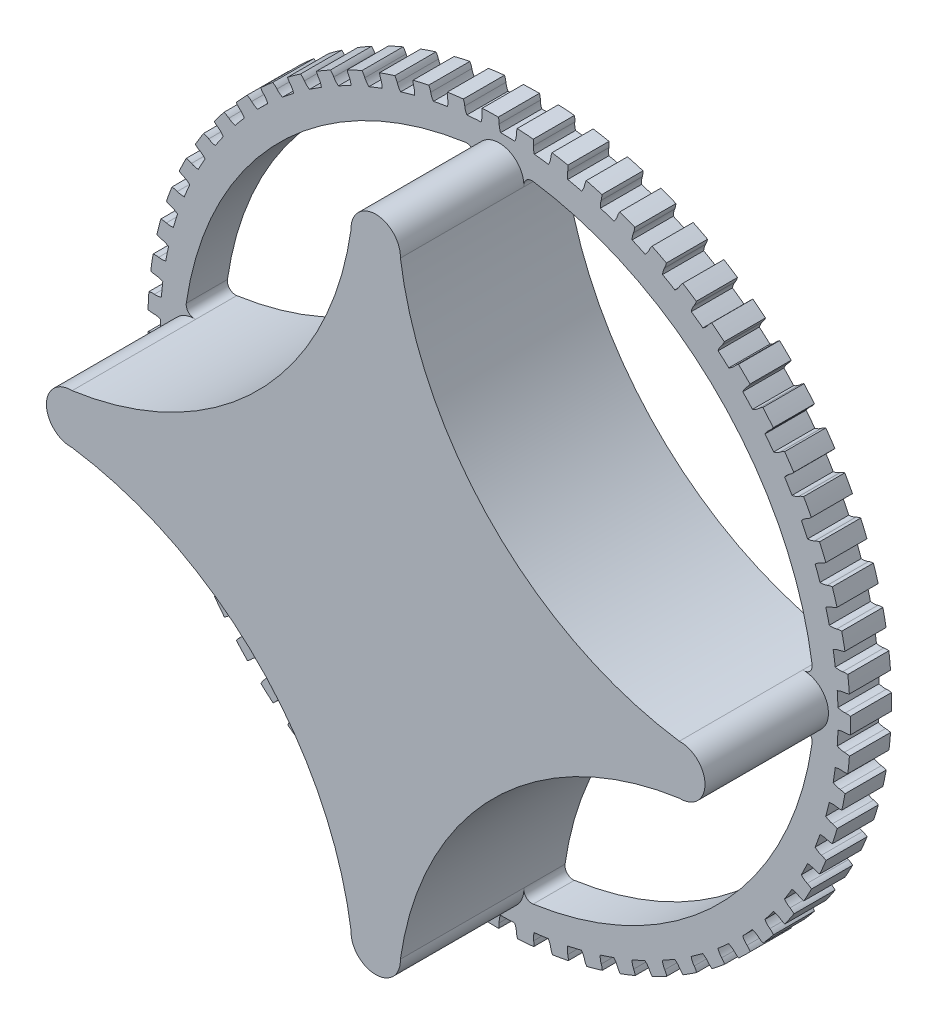
from build123d import *

# Parameters (mm, degrees)
CROQUIS1_R              = 40
SALIENTE_EXTRUIR1_DEPTH = 5
SALIENTE_EXTRUIR2_DEPTH = 15
CORTAR_EXTRUIR1_START   = -15
CORTAR_EXTRUIR1_DEPTH   = 15
CROQUIS4_R              = 42.6665
CROQUIS4_R_2            = 40
SALIENTE_EXTRUIR3_DEPTH = 5
CORTAR_EXTRUIR3_DEPTH   = 15


with BuildPart() as part:
    # Croquis1 → Saliente-Extruir1 (new body)
    with BuildSketch(Plane.XY):
        Circle(CROQUIS1_R)
    extrude(amount=SALIENTE_EXTRUIR1_DEPTH)

    # Croquis2 → Saliente-Extruir2 (add)
    with BuildSketch(Plane.XY.offset(5)):
        with BuildLine():
            ThreePointArc((36.878378378, -2.997533683), (40, 0), (36.878378378, 2.997533683))
            ThreePointArc((36.878378378, 2.997533683), (14.303675748, 14.303675748), (2.997533683, 36.878378378))
            ThreePointArc((2.997533683, 36.878378378), (0, 40), (-2.997533683, 36.878378378))
            ThreePointArc((-2.997533683, 36.878378378), (-14.303675748, 14.303675748), (-36.878378378, 2.997533683))
            ThreePointArc((-36.878378378, 2.997533683), (-40, 0), (-36.878378378, -2.997533683))
            ThreePointArc((-36.878378378, -2.997533683), (-14.303675748, -14.303675748), (-2.997533683, -36.878378378))
            ThreePointArc((-2.997533683, -36.878378378), (0, -40), (2.997533683, -36.878378378))
            ThreePointArc((2.997533683, -36.878378378), (14.303675748, -14.303675748), (36.878378378, -2.997533683))
        make_face()
    extrude(amount=SALIENTE_EXTRUIR2_DEPTH)

    # Croquis3 → Cortar-Extruir1 (cut)
    with BuildSketch(Plane.XY.offset(5).offset(CORTAR_EXTRUIR1_START)):
        with BuildLine():
            ThreePointArc((2.997533683, -36.878378378), (14.303675748, -14.303675748), (36.878378378, -2.997533683))
            ThreePointArc((36.878378378, -2.997533683), (37.728224375, -3.280187235), (38.010877927, -4.130033231))
            ThreePointArc((38.010877927, -4.130033231), (26.704735862, -26.704735862), (4.130033231, -38.010877927))
            ThreePointArc((4.130033231, -38.010877927), (3.280187235, -37.728224375), (2.997533683, -36.878378378))
        make_face()
        with BuildLine():
            ThreePointArc((-36.878378378, -2.997533683), (-14.303675748, -14.303675748), (-2.997533683, -36.878378378))
            ThreePointArc((-2.997533683, -36.878378378), (-3.280187235, -37.728224375), (-4.130033231, -38.010877927))
            ThreePointArc((-4.130033231, -38.010877927), (-26.704735862, -26.704735862), (-38.010877927, -4.130033231))
            ThreePointArc((-38.010877927, -4.130033231), (-37.728224375, -3.280187235), (-36.878378378, -2.997533683))
        make_face()
        with BuildLine():
            ThreePointArc((-2.997533683, 36.878378378), (-14.303675748, 14.303675748), (-36.878378378, 2.997533683))
            ThreePointArc((-36.878378378, 2.997533683), (-37.728224375, 3.280187235), (-38.010877927, 4.130033231))
            ThreePointArc((-38.010877927, 4.130033231), (-26.704735862, 26.704735862), (-4.130033231, 38.010877927))
            ThreePointArc((-4.130033231, 38.010877927), (-3.280187235, 37.728224375), (-2.997533683, 36.878378378))
        make_face()
        with BuildLine():
            ThreePointArc((36.878378378, 2.997533683), (14.303675748, 14.303675748), (2.997533683, 36.878378378))
            ThreePointArc((2.997533683, 36.878378378), (3.280187235, 37.728224375), (4.130033231, 38.010877927))
            ThreePointArc((4.130033231, 38.010877927), (26.704735862, 26.704735862), (38.010877927, 4.130033231))
            ThreePointArc((38.010877927, 4.130033231), (37.728224375, 3.280187235), (36.878378378, 2.997533683))
        make_face()
    extrude(amount=CORTAR_EXTRUIR1_DEPTH, mode=Mode.SUBTRACT)

    # Croquis4 → Saliente-Extruir3 (add)
    with BuildSketch(Plane.XY):
        Circle(CROQUIS4_R)
        Circle(CROQUIS4_R_2, mode=Mode.SUBTRACT)
    extrude(amount=SALIENTE_EXTRUIR3_DEPTH)

    # Croquis8 → Cortar-Extruir3 (cut)
    with BuildSketch(Plane.XY.offset(5)):
        with BuildLine():
            ThreePointArc((2.185445789, 42.61049224), (1.038684561, 42.65385512), (-0.108828076, 42.666361208))
            ThreePointArc((-0.108828076, 42.666361208), (-0.027386058, 42.337594731), (0, 42))
            ThreePointArc((0, 42), (0.043743307, 41.57417464), (0.173146085, 41.166135873))
            ThreePointArc((0.173146085, 41.166135873), (1.037722983, 41.153418488), (1.901842061, 41.122545143))
            ThreePointArc((1.901842061, 41.122545143), (2.045768614, 41.550821832), (2.0945, 42))
            ThreePointArc((2.0945, 42), (2.117361211, 42.308614611), (2.185445789, 42.61049224))
        make_face()
        with BuildLine():
            ThreePointArc((6.417220773, 42.181151001), (5.280475608, 42.338478948), (4.139910423, 42.465178252))
            ThreePointArc((4.139910423, 42.465178252), (4.188213167, 42.129936483), (4.181849557, 41.791292565))
            ThreePointArc((4.181849557, 41.791292565), (4.18297698, 41.3632278), (4.271109185, 40.944332313))
            ThreePointArc((4.271109185, 40.944332313), (5.130123563, 40.845594064), (5.986874647, 40.72883566))
            ThreePointArc((5.986874647, 40.72883566), (6.172728585, 41.140653689), (6.265941516, 41.582747711))
            ThreePointArc((6.265941516, 41.582747711), (6.319417217, 41.887552505), (6.417220773, 42.181151001))
        make_face()
        with BuildLine():
            ThreePointArc((10.585218534, 41.332594533), (9.469786915, 41.60232395), (8.347504632, 41.841957276))
            ThreePointArc((8.347504632, 41.841957276), (8.362188047, 41.503571999), (8.322138014, 41.16724449))
            ThreePointArc((8.322138014, 41.16724449), (8.280638348, 40.741194619), (8.326624082, 40.315605584))
            ThreePointArc((8.326624082, 40.315605584), (9.171538671, 40.131827776), (10.012406983, 39.93034471))
            ThreePointArc((10.012406983, 39.93034471), (10.238341205, 40.321611246), (10.37510929, 40.752227393))
            ThreePointArc((10.37510929, 40.752227393), (10.458668015, 41.050193083), (10.585218534, 41.332594533))
        make_face()
        with BuildLine():
            ThreePointArc((14.648015637, 40.073256171), (13.564983226, 40.452706366), (12.47213759, 40.80289213))
            ThreePointArc((12.47213759, 40.80289213), (12.453055746, 40.46472637), (12.379717325, 40.134057843))
            ThreePointArc((12.379717325, 40.134057843), (12.296003012, 39.714257143), (12.299385249, 39.286204255))
            ThreePointArc((12.299385249, 39.286204255), (13.121802906, 39.019213354), (13.93843152, 38.735008055))
            ThreePointArc((13.93843152, 38.735008055), (14.202200591, 39.101834516), (14.381164567, 39.51669313))
            ThreePointArc((14.381164567, 39.51669313), (14.493975872, 39.8048584), (14.648015637, 40.073256171))
        make_face()
        with BuildLine():
            ThreePointArc((18.56523418, 38.415651785), (17.525364639, 38.901051612), (16.472816841, 39.358309511))
            ThreePointArc((16.472816841, 39.358309511), (16.420159383, 39.02372411), (16.314261444, 38.702000899))
            ThreePointArc((16.314261444, 38.702000899), (16.189164474, 38.292621536), (16.1499096, 37.866358977))
            ThreePointArc((16.1499096, 37.866358977), (16.94165677, 37.518808459), (17.725929662, 37.154705487))
            ThreePointArc((17.725929662, 37.154705487), (18.024912126, 37.493446187), (18.244293369, 37.888424218))
            ThreePointArc((18.244293369, 37.888424218), (18.385236085, 38.16392515), (18.56523418, 38.415651785))
        make_face()
        with BuildLine():
            ThreePointArc((22.297943085, 36.376255393), (21.311571104, 36.96278073), (20.309781837, 37.52256633))
            ThreePointArc((20.309781837, 37.52256633), (20.224072098, 37.194886549), (20.086667102, 36.885306082))
            ThreePointArc((20.086667102, 36.885306082), (19.921430746, 36.490416653), (19.839928893, 36.070180812))
            ThreePointArc((19.839928893, 36.070180812), (20.593136836, 35.645524789), (21.337259552, 35.205142764))
            ThreePointArc((21.337259552, 35.205142764), (21.668483987, 35.512431145), (21.926102188, 35.883603123))
            ThreePointArc((21.926102188, 35.883603123), (22.093775562, 36.143701667), (22.297943085, 36.376255393))
        make_face()
        with BuildLine():
            ThreePointArc((25.809045013, 33.975335433), (24.885973602, 34.657157127), (23.944899097, 35.313907027))
            ThreePointArc((23.944899097, 35.313907027), (23.826988899, 34.996389494), (23.659442439, 34.702028521))
            ThreePointArc((23.659442439, 34.702028521), (23.455708889, 34.325553615), (23.332770059, 33.915520984))
            ThreePointArc((23.332770059, 33.915520984), (24.039953058, 33.41797988), (24.736530171, 32.905695516))
            ThreePointArc((24.736530171, 32.905695516), (25.096704719, 33.178477607), (25.389999551, 33.52215466))
            ThreePointArc((25.389999551, 33.52215466), (25.582737171, 33.764265839), (25.809045013, 33.975335433))
        make_face()
        with BuildLine():
            ThreePointArc((29.063645057, 31.236753324), (28.213048113, 32.007095126), (27.342041192, 32.75428225))
            ThreePointArc((27.342041192, 32.75428225), (27.193102379, 32.450082598), (26.997079607, 32.173866611))
            ThreePointArc((26.997079607, 32.173866611), (26.756873659, 31.819547804), (26.593719674, 31.423793472))
            ThreePointArc((26.593719674, 31.423793472), (27.247849425, 30.858312073), (27.889958039, 30.279216681))
            ThreePointArc((27.889958039, 30.279216681), (28.275503124, 30.514781454), (28.601559693, 30.827547963))
            ThreePointArc((28.601559693, 30.827547963), (28.817446045, 31.049265567), (29.063645057, 31.236753324))
        make_face()
        with BuildLine():
            ThreePointArc((32.02939754, 28.187726327), (31.259728677, 29.038932234), (30.467445798, 29.869130701))
            ThreePointArc((30.467445798, 29.869130701), (30.288958591, 29.581272202), (30.066407669, 29.32594636))
            ThreePointArc((30.066407669, 29.32594636), (29.792116598, 28.997305031), (29.590368955, 28.619762182))
            ThreePointArc((29.590368955, 28.619762182), (30.184944423, 27.991960496), (30.766202974, 27.351809388))
            ThreePointArc((30.766202974, 27.351809388), (31.173286876, 27.547815692), (31.528864684, 27.826563244))
            ThreePointArc((31.528864684, 27.826563244), (31.765754193, 28.025683745), (32.02939754, 28.187726327))
        make_face()
        with BuildLine():
            ThreePointArc((34.676827479, 24.858557043), (33.995736013, 25.782167387), (33.290051239, 26.687126311))
            ThreePointArc((33.290051239, 26.687126311), (33.083789524, 26.418469832), (32.836922264, 26.186571678))
            ThreePointArc((32.836922264, 26.186571678), (32.531272097, 25.886874014), (32.292935855, 25.531294838))
            ThreePointArc((32.292935855, 25.531294838), (32.822047882, 24.847412241), (33.336679561, 24.152567525))
            ThreePointArc((33.336679561, 24.152567525), (33.761256498, 24.307067362), (34.142821654, 24.549025638))
            ThreePointArc((34.142821654, 24.549025638), (34.398360004, 24.723570086), (34.676827479, 24.858557043))
        make_face()
        with BuildLine():
            ThreePointArc((36.979623528, 21.28233225), (36.393878451, 22.269167778), (35.781805195, 23.239893271))
            ThreePointArc((35.781805195, 23.239893271), (35.549818894, 22.993108841), (35.281088772, 22.786943082))
            ThreePointArc((35.281088772, 22.786943082), (34.947117199, 22.519167612), (34.67456105, 22.189086016))
            ThreePointArc((34.67456105, 22.189086016), (35.132951084, 21.455919239), (35.57584125, 20.713286595))
            ThreePointArc((35.57584125, 20.713286595), (36.013691585, 20.824744477), (36.417451922, 21.027508786))
            ThreePointArc((36.417451922, 21.027508786), (36.68909946, 21.17574248), (36.979623528, 21.28233225))
        make_face()
        with BuildLine():
            ThreePointArc((38.914899464, 17.494594077), (38.430322175, 18.534847174), (37.917943495, 19.56169173))
            ThreePointArc((37.917943495, 19.56169173), (37.662538192, 19.339232004), (37.37461597, 19.160847609))
            ThreePointArc((37.37461597, 19.160847609), (37.01564215, 18.927655605), (36.71157488, 18.626352087))
            ThreePointArc((36.71157488, 18.626352087), (37.094687233, 17.851187673), (37.461434246, 17.068147717))
            ThreePointArc((37.461434246, 17.068147717), (37.908206425, 17.135455924), (38.330149192, 17.297011105))
            ThreePointArc((38.330149192, 17.297011105), (38.615206162, 17.417460833), (38.914899464, 17.494594077))
        make_face()
        with BuildLine():
            ThreePointArc((40.463421647, 13.532986769), (40.084828092, 14.616318932), (39.677236238, 15.689077308))
            ThreePointArc((39.677236238, 15.689077308), (39.400950265, 15.493153191), (39.096697443, 15.344323023))
            ThreePointArc((39.096697443, 15.344323023), (38.716289018, 15.148032054), (38.383732585, 14.878501104))
            ThreePointArc((38.383732585, 14.878501104), (38.687759715, 14.069042984), (38.974718678, 13.253377919))
            ThreePointArc((38.974718678, 13.253377919), (39.425972479, 13.275867512), (39.861904219, 13.394607957))
            ThreePointArc((39.861904219, 13.394607957), (40.157537596, 13.486076634), (40.463421647, 13.532986769))
        make_face()
        with BuildLine():
            ThreePointArc((41.609800166, 9.436882559), (41.340952978, 10.552527145), (41.042198781, 11.660537788))
            ThreePointArc((41.042198781, 11.660537788), (40.747777993, 11.493096461), (40.430218372, 11.375299662))
            ThreePointArc((40.430218372, 11.375299662), (40.032156013, 11.217860554), (39.674415511, 10.982780892))
            ThreePointArc((39.674415511, 10.982780892), (39.89633586, 10.147073824), (40.100654845, 9.306890096))
            ThreePointArc((40.100654845, 9.306890096), (40.551905505, 9.284337565), (40.997493732, 9.359083177))
            ThreePointArc((40.997493732, 9.359083177), (41.300765381, 9.420661746), (41.609800166, 9.436882559))
        make_face()
        with BuildLine():
            ThreePointArc((42.342641797, 5.24699037), (42.1862129, 6.383859603), (41.999265513, 7.516110604))
            ThreePointArc((41.999265513, 7.516110604), (41.689635996, 7.378816174), (41.361925627, 7.293223462))
            ThreePointArc((41.361925627, 7.293223462), (40.950165456, 7.176200916), (40.570796271, 6.977908869))
            ThreePointArc((40.570796271, 6.977908869), (40.708404295, 6.124258486), (40.828052688, 5.267906219))
            ThreePointArc((40.828052688, 5.267906219), (41.274815476, 5.200535699), (41.725631735, 5.230543623))
            ThreePointArc((41.725631735, 5.230543623), (42.033527604, 5.26162009), (42.342641797, 5.24699037))
        make_face()
        with BuildLine():
            ThreePointArc((42.65466323, 1.004951233), (42.612207285, 2.151746396), (42.538924676, 3.296984936))
            ThreePointArc((42.538924676, 3.296984936), (42.217163666, 3.191201898), (41.882559482, 3.138663931))
            ThreePointArc((41.882559482, 3.138663931), (41.461193757, 3.063220969), (41.063966231, 2.903687253))
            ThreePointArc((41.063966231, 2.903687253), (41.115894319, 2.040577516), (41.149683001, 1.176567523))
            ThreePointArc((41.149683001, 1.176567523), (41.587517786, 1.065048574), (42.039081663, 1.050020577))
            ThreePointArc((42.039081663, 1.050020577), (42.348541745, 1.05028609), (42.65466323, 1.004951233))
        make_face()
        with BuildLine():
            ThreePointArc((42.542763457, -3.24707556), (42.61470241, -2.101751833), (42.655812894, -0.954907649))
            ThreePointArc((42.655812894, -0.954907649), (42.325118198, -1.028127977), (41.986945644, -1.047089053))
            ThreePointArc((41.986945644, -1.047089053), (41.560162087, -1.080202643), (41.149024045, -1.199392511))
            ThreePointArc((41.149024045, -1.199392511), (41.114756113, -2.06338363), (41.062349278, -2.92646443))
            ThreePointArc((41.062349278, -2.92646443), (41.486904662, -3.081023483), (41.93472831, -3.140938045))
            ThreePointArc((41.93472831, -3.140938045), (42.242677052, -3.171486126), (42.542763457, -3.24707556))
        make_face()
        with BuildLine():
            ThreePointArc((42.008054587, -7.466831458), (42.193673477, -6.334361908), (42.348768479, -5.197309933))
            ThreePointArc((42.348768479, -5.197309933), (42.012426689, -5.237239854), (41.674046677, -5.222435595))
            ThreePointArc((41.674046677, -5.222435595), (41.246086855, -5.212890717), (40.825124371, -5.290552174))
            ThreePointArc((40.825124371, -5.290552174), (40.705000989, -6.146837943), (40.566919478, -7.000411865))
            ThreePointArc((40.566919478, -7.000411865), (40.973976039, -7.196474944), (41.413608788, -7.300680613))
            ThreePointArc((41.413608788, -7.300680613), (41.716985657, -7.361738687), (42.008054587, -7.466831458))
        make_face()
        with BuildLine():
            ThreePointArc((41.055850799, -11.61237863), (41.35330486, -10.504018249), (41.620842978, -9.388059016))
            ThreePointArc((41.620842978, -9.388059016), (41.282196809, -9.394301688), (40.946972312, -9.345879226))
            ThreePointArc((40.946972312, -9.345879226), (40.522089481, -9.293770741), (40.09548627, -9.329131953))
            ThreePointArc((40.09548627, -9.329131953), (39.890701278, -10.169202218), (39.668317408, -11.004786061))
            ThreePointArc((39.668317408, -11.004786061), (40.053829635, -11.240404605), (40.480902215, -11.387865738))
            ThreePointArc((40.480902215, -11.387865738), (40.776692116, -11.478826982), (41.055850799, -11.61237863))
        make_face()
        with BuildLine():
            ThreePointArc((39.695615519, -15.642516767), (40.101948522, -14.569280937), (40.479270839, -13.48550535))
            ThreePointArc((40.479270839, -13.48550535), (40.14168591, -13.457998732), (39.812948539, -13.376439311))
            ThreePointArc((39.812948539, -13.376439311), (39.395365376, -13.282285095), (38.967361213, -13.274994627))
            ThreePointArc((38.967361213, -13.274994627), (38.679949857, -14.090500394), (38.375473778, -14.89978975))
            ThreePointArc((38.375473778, -14.89978975), (38.735610277, -15.172622074), (39.14587825, -15.361873137))
            ThreePointArc((39.14587825, -15.361873137), (39.431141489, -15.481833538), (39.695615519, -15.642516767))
        make_face()
        with BuildLine():
            ThreePointArc((37.940867379, -19.517192543), (38.452041002, -18.489747566), (38.935397522, -17.448926674))
            ThreePointArc((38.935397522, -17.448926674), (38.602228903, -17.387944138), (38.283245797, -17.274058331))
            ThreePointArc((38.283245797, -17.274058331), (37.877112431, -17.138794133), (37.451961013, -17.08892444))
            ThreePointArc((37.451961013, -17.08892444), (37.084779715, -17.871760846), (36.701237448, -18.646712634))
            ThreePointArc((36.701237448, -18.646712634), (37.032419021, -18.954047208), (37.42180496, -19.183207339))
            ThreePointArc((37.42180496, -19.183207339), (37.693706462, -19.330974676), (37.940867379, -19.517192543))
        make_face()
        with BuildLine():
            ThreePointArc((35.809045853, -23.197897692), (36.419979823, -22.226454777), (37.004566731, -21.238932726))
            ThreePointArc((37.004566731, -21.238932726), (36.679125601, -21.145080343), (36.373066959, -21))
            ThreePointArc((36.373066959, -21), (35.982419726, -20.824970135), (35.564346399, -20.733016844))
            ThreePointArc((35.564346399, -20.733016844), (35.121044372, -21.475403709), (34.662247732, -22.20831611))
            ThreePointArc((34.662247732, -22.20831611), (34.961182947, -22.547098506), (35.325816959, -22.813890208))
            ThreePointArc((35.325816959, -22.813890208), (35.581654446, -22.987995903), (35.809045853, -23.197897692))
        make_face()
        with BuildLine():
            ThreePointArc((33.321337941, -26.648051712), (34.025960523, -25.742265494), (34.705967931, -24.817856721))
            ThreePointArc((34.705967931, -24.817856721), (34.391488671, -24.69206724), (34.10139624, -24.517234234))
            ThreePointArc((34.10139624, -24.517234234), (33.730117567, -24.304178228), (33.323277332, -24.171055213))
            ThreePointArc((33.323277332, -24.171055213), (32.808260311, -24.865614362), (32.278769025, -25.549203363))
            ThreePointArc((32.278769025, -25.549203363), (32.54248693, -25.916066609), (32.878745119, -26.217838387))
            ThreePointArc((32.878745119, -26.217838387), (33.115975963, -26.416552099), (33.321337941, -26.648051712))
        make_face()
        with BuildLine():
            ThreePointArc((30.502467603, -29.833365421), (31.29377594, -29.002238012), (32.062445629, -28.150129707))
            ThreePointArc((32.062445629, -28.150129707), (31.762053675, -27.99365328), (31.490810525, -27.790805179))
            ThreePointArc((31.490810525, -27.790805179), (31.142590347, -27.541840478), (30.751026564, -27.368870775))
            ThreePointArc((30.751026564, -27.368870775), (30.169413019, -28.008699369), (29.574489409, -28.636171155))
            ThreePointArc((29.574489409, -28.636171155), (29.800369058, -29.027469199), (30.104909538, -29.361221909))
            ThreePointArc((30.104909538, -29.361221909), (30.321176032, -29.582568732), (30.502467603, -29.833365421))
        make_face()
        with BuildLine():
            ThreePointArc((27.380450038, -32.722181742), (28.250579752, -31.973973258), (29.100272338, -31.202634057))
            ThreePointArc((29.100272338, -31.202634057), (28.81695312, -31.017025816), (28.567254986, -30.788178617))
            ThreePointArc((28.567254986, -30.788178617), (28.245554072, -30.505779545), (27.873158278, -30.294682204))
            ThreePointArc((27.873158278, -30.294682204), (27.230728547, -30.873421337), (26.576285231, -31.438539813))
            ThreePointArc((26.576285231, -31.438539813), (26.76208173, -31.850383759), (27.031877841, -32.212800416))
            ThreePointArc((27.031877841, -32.212800416), (27.225030632, -32.454580507), (27.380450038, -32.722181742))
        make_face()
        with BuildLine():
            ThreePointArc((23.986313259, -35.28579032), (24.926616611, -34.627936794), (25.848887467, -33.945032611))
            ThreePointArc((25.848887467, -33.945032611), (25.585456738, -33.732137215), (25.359785234, -33.479565303))
            ThreePointArc((25.359785234, -33.479565303), (25.067800791, -33.166538468), (24.718274023, -32.919411471))
            ThreePointArc((24.718274023, -32.919411471), (24.02141286, -33.431309374), (23.313953991, -33.928458137))
            ThreePointArc((23.313953991, -33.928458137), (23.45782081, -34.356754896), (23.690191197, -34.744233641))
            ThreePointArc((23.690191197, -34.744233641), (23.858310646, -35.004044079), (23.986313259, -35.28579032))
        make_face()
        with BuildLine():
            ThreePointArc((20.353789723, -37.49871286), (21.354921555, -36.937752336), (22.340604738, -36.350070181))
            ThreePointArc((22.340604738, -36.350070181), (22.099680593, -36.112003479), (21.900278542, -35.838217029))
            ThreePointArc((21.900278542, -35.838217029), (21.640912443, -35.497673432), (21.317728456, -35.216972836))
            ThreePointArc((21.317728456, -35.216972836), (20.57336158, -35.656942039), (19.819918201, -36.081180202))
            ThreePointArc((19.819918201, -36.081180202), (19.920425528, -36.521673167), (20.11306079, -36.930363062))
            ThreePointArc((20.11306079, -36.930363062), (20.25447605, -37.205621736), (20.353789723, -37.49871286))
        make_face()
        with BuildLine():
            ThreePointArc((16.51898108, -39.338956345), (17.570991694, -38.880463901), (18.610291043, -38.393844422))
            ThreePointArc((18.610291043, -38.393844422), (18.394267893, -38.132972429), (18.223117043, -37.840692452))
            ThreePointArc((18.223117043, -37.840692452), (17.998946985, -37.476016569), (17.705317725, -37.164532104))
            ThreePointArc((17.705317725, -37.164532104), (16.92084299, -37.528199994), (16.12890316, -37.875311287))
            ThreePointArc((16.12890316, -37.875311287), (16.185052107, -38.323622642), (16.336037749, -38.749461943))
            ThreePointArc((16.336037749, -38.749461943), (16.449343371, -39.037433208), (16.51898108, -39.338956345))
        make_face()
        with BuildLine():
            ThreePointArc((12.519999382, -40.788231608), (13.612433424, -40.436763947), (14.695019915, -40.056043389))
            ThreePointArc((14.695019915, -40.056043389), (14.506044695, -39.774958767), (14.36484602, -39.467090073))
            ThreePointArc((14.36484602, -39.467090073), (14.178099906, -39.081906216), (13.916943593, -38.742733555))
            ThreePointArc((13.916943593, -38.742733555), (13.10015746, -39.026485837), (12.277591833, -39.293020513))
            ThreePointArc((12.277591833, -39.293020513), (12.288824367, -39.744694737), (12.396659825, -40.183451263))
            ThreePointArc((12.396659825, -40.183451263), (12.480729728, -40.48127313), (12.519999382, -40.788231608))
        make_face()
        with BuildLine():
            ThreePointArc((8.396588305, -41.832135101), (9.518588675, -41.591185267), (10.633703077, -41.3201474))
            ThreePointArc((10.633703077, -41.3201474), (10.473653907, -41.021643695), (10.363810703, -40.701246022))
            ThreePointArc((10.363810703, -40.701246022), (10.2163445, -40.299382322), (9.990256623, -39.935892313))
            ThreePointArc((9.990256623, -39.935892313), (9.14927668, -40.13690893), (8.304260283, -40.320218048))
            ThreePointArc((8.304260283, -40.320218048), (8.27046477, -40.770766201), (8.334078327, -41.218079391))
            ThreePointArc((8.334078327, -41.218079391), (8.388076985, -41.522791974), (8.396588305, -41.832135101))
        make_face()
        with BuildLine():
            ThreePointArc((4.189728161, -42.460292041), (5.330143915, -42.332254701), (6.46670372, -42.173593222))
            ThreePointArc((6.46670372, -42.173593222), (6.337171242, -41.860637098), (6.259775179, -41.530894701))
            ThreePointArc((6.259775179, -41.530894701), (6.153054472, -41.11634506), (5.964281994, -40.732150232))
            ThreePointArc((5.964281994, -40.732150232), (5.107466278, -40.848433391), (4.248397263, -40.946695141))
            ThreePointArc((4.248397263, -40.946695141), (4.169909578, -41.391639472), (4.188669014, -41.843063728))
            ThreePointArc((4.188669014, -41.843063728), (4.212059765, -42.151638655), (4.189728161, -42.460292041))
        make_face()
        with BuildLine():
            ThreePointArc((-0.058771384, -42.666459522), (1.088725791, -42.65260717), (2.235435356, -42.607898928))
            ThreePointArc((2.235435356, -42.607898928), (2.137706921, -42.283600683), (2.093527198, -41.947790691))
            ThreePointArc((2.093527198, -41.947790691), (2.028612625, -41.524675089), (1.879031651, -41.123593743))
            ThreePointArc((1.879031651, -41.123593743), (1.014895581, -41.153987768), (0.150311762, -41.166225581))
            ThreePointArc((0.150311762, -41.166225581), (0.027911951, -41.601144035), (0.001630826, -42.052192899))
            ThreePointArc((0.001630826, -42.052192899), (-0.005818798, -42.361563415), (-0.058771384, -42.666459522))
        make_face()
        with BuildLine():
            ThreePointArc((-4.306686832, -42.44858856), (-3.16351258, -42.549058866), (-2.018049768, -42.618748191))
            ThreePointArc((-2.018049768, -42.618748191), (-2.083002891, -42.286330847), (-2.093527198, -41.947790691))
            ThreePointArc((-2.093527198, -41.947790691), (-2.115990486, -41.520314242), (-2.224893352, -41.106332503))
            ThreePointArc((-2.224893352, -41.106332503), (-3.087761604, -41.050535326), (-3.949267604, -40.976627578))
            ThreePointArc((-3.949267604, -40.976627578), (-4.114363077, -41.397197738), (-4.185423569, -41.843388484))
            ThreePointArc((-4.185423569, -41.843388484), (-4.223639531, -42.150479925), (-4.306686832, -42.44858856))
        make_face()
        with BuildLine():
            ThreePointArc((-8.511800492, -41.808844455), (-7.384310541, -42.0226389), (-6.251478608, -42.206033188))
            ThreePointArc((-6.251478608, -42.206033188), (-6.283010884, -41.868800458), (-6.259775179, -41.530894701))
            ThreePointArc((-6.259775179, -41.530894701), (-6.239563933, -41.103305857), (-6.306706366, -40.680538063))
            ThreePointArc((-6.306706366, -40.680538063), (-7.159731227, -40.539104221), (-8.009597375, -40.379785439))
            ThreePointArc((-8.009597375, -40.379785439), (-8.215747716, -40.781827492), (-8.330881345, -41.218725675))
            ThreePointArc((-8.330881345, -41.218725675), (-8.399483836, -41.520486029), (-8.511800492, -41.808844455))
        make_face()
        with BuildLine():
            ThreePointArc((-12.632320054, -40.753585269), (-11.531719907, -41.078579068), (-10.422777444, -41.373855665))
            ThreePointArc((-10.422777444, -41.373855665), (-10.420575493, -41.03515912), (-10.363810703, -40.701246022))
            ThreePointArc((-10.363810703, -40.701246022), (-10.301125791, -40.277794352), (-10.325840499, -39.850442159))
            ThreePointArc((-10.325840499, -39.850442159), (-11.160544224, -39.624777285), (-11.990324169, -39.381630852))
            ThreePointArc((-11.990324169, -39.381630852), (-12.235480564, -39.761149122), (-12.393543079, -40.184412652))
            ThreePointArc((-12.393543079, -40.184412652), (-12.491850298, -40.477842889), (-12.632320054, -40.753585269))
        make_face()
        with BuildLine():
            ThreePointArc((-16.627293945, -39.293298644), (-15.564521859, -39.726261862), (-14.490490036, -40.130486177))
            ThreePointArc((-14.490490036, -40.130486177), (-14.454575741, -39.793691934), (-14.36484602, -39.467090073))
            ThreePointArc((-14.36484602, -39.467090073), (-14.260310432, -39.051984032), (-14.24235179, -38.624294657))
            ThreePointArc((-14.24235179, -38.624294657), (-15.050438719, -38.31664151), (-15.851885734, -37.992083925))
            ThreePointArc((-15.851885734, -37.992083925), (-16.133611709, -38.345306588), (-16.333032214, -38.750728883))
            ThreePointArc((-16.333032214, -38.750728883), (-16.460067139, -39.032912761), (-16.627293945, -39.293298644))
        make_face()
        with BuildLine():
            ThreePointArc((-20.457018318, -37.442497564), (-19.442636601, -37.979127218), (-18.414189627, -38.488281887))
            ThreePointArc((-18.414189627, -38.488281887), (-18.344919921, -38.15673716), (-18.223117043, -37.840692452))
            ThreePointArc((-18.223117043, -37.840692452), (-18.077769702, -37.438057549), (-18.01731619, -37.014281562))
            ThreePointArc((-18.01731619, -37.014281562), (-18.790755192, -36.627697738), (-19.555904137, -36.224954598))
            ThreePointArc((-19.555904137, -36.224954598), (-19.871399772, -36.54837117), (-20.110196337, -36.93192296))
            ThreePointArc((-20.110196337, -36.93192296), (-20.264696437, -37.200056009), (-20.457018318, -37.442497564))
        make_face()
        with BuildLine():
            ThreePointArc((-24.083431652, -35.219576121), (-23.127521685, -35.854538945), (-22.154880729, -36.463563761))
            ThreePointArc((-22.154880729, -36.463563761), (-22.052944045, -36.140563589), (-21.900278542, -35.838217029))
            ThreePointArc((-21.900278542, -35.838217029), (-21.715563974, -35.452054831), (-21.613216407, -35.036403908))
            ThreePointArc((-21.613216407, -35.036403908), (-22.344320698, -34.574731449), (-23.065567179, -34.097805398))
            ThreePointArc((-23.065567179, -34.097805398), (-23.411696937, -34.38820162), (-23.687496294, -34.746070995))
            ThreePointArc((-23.687496294, -34.746070995), (-23.867926079, -34.997488388), (-24.083431652, -35.219576121))
        make_face()
        with BuildLine():
            ThreePointArc((-27.470493022, -32.646626707), (-26.582555068, -33.373612156), (-25.675386673, -34.076454356))
            ThreePointArc((-25.675386673, -34.076454356), (-25.541796104, -33.76520886), (-25.359785234, -33.479565303))
            ThreePointArc((-25.359785234, -33.479565303), (-25.137539215, -33.113713664), (-24.994314769, -32.710318731))
            ThreePointArc((-24.994314769, -32.710318731), (-25.675818306, -32.178145947), (-26.345994251, -31.631776889))
            ThreePointArc((-26.345994251, -31.631776889), (-26.719318139, -31.886266672), (-27.02937927, -32.214896966))
            ThreePointArc((-27.02937927, -32.214896966), (-27.233945548, -32.447100004), (-27.470493022, -32.646626707))
        make_face()
        with BuildLine():
            ThreePointArc((-30.584540292, -29.74922045), (-29.773399076, -30.561003415), (-28.940719089, -31.350677838))
            ThreePointArc((-28.940719089, -31.350677838), (-28.776802317, -31.054280316), (-28.567254986, -30.788178617))
            ThreePointArc((-28.567254986, -30.788178617), (-28.309686299, -30.446273534), (-28.127008402, -30.059143711))
            ThreePointArc((-28.127008402, -30.059143711), (-28.752138097, -29.461759573), (-29.364582996, -28.85137757))
            ThreePointArc((-29.364582996, -28.85137757), (-29.761390754, -29.067431681), (-30.102632132, -29.363556818))
            ThreePointArc((-30.102632132, -29.363556818), (-30.32930183, -29.574237763), (-30.584540292, -29.74922045))
        make_face()
        with BuildLine():
            ThreePointArc((-33.394624659, -26.556153075), (-32.668341667, -27.444665692), (-31.918425636, -28.313324198))
            ThreePointArc((-31.918425636, -28.313324198), (-31.725811741, -28.034720383), (-31.490810525, -27.790805179))
            ThreePointArc((-31.490810525, -27.790805179), (-31.200479001, -27.476244659), (-30.980163188, -27.109227416))
            ThreePointArc((-30.980163188, -27.109227416), (-31.542706221, -26.452568996), (-32.091333323, -25.784240299))
            ThreePointArc((-32.091333323, -25.784240299), (-32.507681296, -25.959711494), (-32.876711511, -26.220388449))
            ThreePointArc((-32.876711511, -26.220388449), (-33.123231885, -26.40745346), (-33.394624659, -26.556153075))
        make_face()
        with BuildLine():
            ThreePointArc((-35.872818243, -23.09915872), (-35.238611603, -24.055570552), (-34.57891253, -24.994580023))
            ThreePointArc((-34.57891253, -24.994580023), (-34.359515794, -24.736538803), (-34.10139624, -24.517234234))
            ThreePointArc((-34.10139624, -24.517234234), (-33.781187325, -24.233144521), (-33.525423195, -23.889887439))
            ThreePointArc((-33.525423195, -23.889887439), (-34.01978876, -23.180480904), (-34.499145562, -22.460847663))
            ThreePointArc((-34.499145562, -22.460847663), (-34.930895897, -22.593992032), (-35.324047362, -22.816630081))
            ThreePointArc((-35.324047362, -22.816630081), (-35.58796838, -22.978220021), (-35.872818243, -23.09915872))
        make_face()
        with BuildLine():
            ThreePointArc((-37.994491642, -19.412594548), (-37.458664384, -20.427400344), (-36.895738655, -21.427428482))
            ThreePointArc((-36.895738655, -21.427428482), (-36.651739543, -21.192514388), (-36.373066959, -21))
            ThreePointArc((-36.373066959, -21), (-36.026163033, -20.749204505), (-35.737492484, -20.433119028))
            ThreePointArc((-35.737492484, -20.433119028), (-36.158767355, -19.678014779), (-36.564089792, -18.914229033))
            ThreePointArc((-36.564089792, -18.914229033), (-37.006951561, -19.003723326), (-37.420316959, -19.186109792))
            ThreePointArc((-37.420316959, -19.186109792), (-37.699015657, -19.320618708), (-37.994491642, -19.412594548))
        make_face()
        with BuildLine():
            ThreePointArc((-39.738558715, -15.533099289), (-39.30643613, -16.596213454), (-38.845878354, -17.64732153))
            ThreePointArc((-38.845878354, -17.64732153), (-38.579701837, -17.437869243), (-38.283245797, -17.274058331))
            ThreePointArc((-38.283245797, -17.274058331), (-37.913094547, -17.059049572), (-37.594386517, -16.7732771))
            ThreePointArc((-37.594386517, -16.7732771), (-37.938383874, -15.979979702), (-38.265643671, -15.179632297))
            ThreePointArc((-38.265643671, -15.179632297), (-38.715215515, -15.224587079), (-39.144686635, -15.364909324))
            ThreePointArc((-39.144686635, -15.364909324), (-39.43539318, -15.471000405), (-39.738558715, -15.533099289))
        make_face()
        with BuildLine():
            ThreePointArc((-41.087686137, -11.499229112), (-40.763562855, -12.600085938), (-40.409950261, -13.691827568))
            ThreePointArc((-40.409950261, -13.691827568), (-40.124241722, -13.509918719), (-39.812948539, -13.376439311))
            ThreePointArc((-39.812948539, -13.376439311), (-39.423228695, -13.199354141), (-39.077650646, -12.946734809))
            ThreePointArc((-39.077650646, -12.946734809), (-39.34095169, -12.123128408), (-39.586896392, -11.294173555))
            ThreePointArc((-39.586896392, -11.294173555), (-40.038710263, -11.294142047), (-40.480018828, -11.391005484))
            ThreePointArc((-40.480018828, -11.391005484), (-40.779844047, -11.467624351), (-41.087686137, -11.499229112))
        make_face()
        with BuildLine():
            ThreePointArc((-42.028465675, -7.351074429), (-41.815562978, -8.478733108), (-41.572409928, -9.600258073))
            ThreePointArc((-41.572409928, -9.600258073), (-41.270008866, -9.447700554), (-40.946972312, -9.345879226))
            ThreePointArc((-40.946972312, -9.345879226), (-40.541557084, -9.208477598), (-40.172543527, -8.991522051))
            ThreePointArc((-40.172543527, -8.991522051), (-40.352531453, -8.145792016), (-40.514716751, -7.296468242))
            ThreePointArc((-40.514716751, -7.296468242), (-40.96428232, -7.251450757), (-41.413042408, -7.303892714))
            ThreePointArc((-41.413042408, -7.303892714), (-41.719006504, -7.350277893), (-42.028465675, -7.351074429))
        make_face()
        with BuildLine():
            ThreePointArc((-42.551547439, -3.129861466), (-42.451981249, -4.273114818), (-42.321704307, -5.4132769))
            ThreePointArc((-42.321704307, -5.4132769), (-42.005616121, -5.291586896), (-41.674046677, -5.222435595))
            ThreePointArc((-41.674046677, -5.222435595), (-41.256965265, -5.126083068), (-40.868183623, -4.946947507))
            ThreePointArc((-40.868183623, -4.946947507), (-40.96306963, -4.087499085), (-41.039883653, -3.22624735))
            ThreePointArc((-41.039883653, -3.22624735), (-41.482732936, -3.136691291), (-41.934484567, -3.144190577))
            ThreePointArc((-41.934484567, -3.144190577), (-42.243546731, -3.159881071), (-42.551547439, -3.129861466))
        make_face()
        with BuildLine():
            ThreePointArc((-42.651732808, 1.122457467), (-42.666492659, -0.025028394), (-42.650386575, -1.172496149))
            ThreePointArc((-42.650386575, -1.172496149), (-42.323752691, -1.082883069), (-41.986945644, -1.047089053))
            ThreePointArc((-41.986945644, -1.047089053), (-41.562343189, -0.992743221), (-41.157657348, -0.853207976))
            ThreePointArc((-41.157657348, -0.853207976), (-41.166498417, 0.011417249), (-41.157177754, 0.876037437))
            ThreePointArc((-41.157177754, 0.876037437), (-41.588909515, 1.009242022), (-42.039162978, 1.046759939))
            ThreePointArc((-42.039162978, 1.046759939), (-42.348251611, 1.061920068), (-42.651732808, 1.122457467))
        make_face()
        with BuildLine():
            ThreePointArc((-42.328026093, 5.363620913), (-42.456965296, 4.223306773), (-42.55519014, 3.079937396))
            ThreePointArc((-42.55519014, 3.079937396), (-42.221256792, 3.136582935), (-41.882559482, 3.138663931))
            ThreePointArc((-41.882559482, 3.138663931), (-41.454655874, 3.150462954), (-41.038087784, 3.24901112))
            ThreePointArc((-41.038087784, 3.24901112), (-40.960796048, 4.110220114), (-40.865433331, 4.969615772))
            ThreePointArc((-40.865433331, 4.969615772), (-41.281756826, 5.145145034), (-41.726037301, 5.227307284))
            ThreePointArc((-41.726037301, 5.227307284), (-42.032080542, 5.273167369), (-42.328026093, 5.363620913))
        make_face()
        with BuildLine():
            ThreePointArc((-41.583644439, 9.551478284), (-41.825481537, 8.429668821), (-42.037061107, 7.301761139))
            ThreePointArc((-42.037061107, 7.301761139), (-41.699147074, 7.324876169), (-41.361925627, 7.293223462))
            ThreePointArc((-41.361925627, 7.293223462), (-40.934973565, 7.262358412), (-40.510663267, 7.318940083))
            ThreePointArc((-40.510663267, 7.318940083), (-40.348006885, 8.168173764), (-40.167549872, 9.013803831))
            ThreePointArc((-40.167549872, 9.013803831), (-40.564327492, 9.229913284), (-40.998219518, 9.355903301))
            ThreePointArc((-40.998219518, 9.355903301), (-41.298175772, 9.432007563), (-41.583644439, 9.551478284))
        make_face()
        with BuildLine():
            ThreePointArc((-40.425985844, 13.644408773), (-40.778317352, 12.552253032), (-41.101148875, 11.451016699))
            ThreePointArc((-41.101148875, 11.451016699), (-40.762612498, 11.440371493), (-40.430218372, 11.375299662))
            ThreePointArc((-40.430218372, 11.375299662), (-40.008461097, 11.30207729), (-39.580625578, 11.316130131))
            ThreePointArc((-39.580625578, 11.316130131), (-39.334221103, 12.144948434), (-39.070463257, 12.968408659))
            ThreePointArc((-39.070463257, 12.968408659), (-39.443751647, 13.222950508), (-39.862943011, 13.391516147))
            ThreePointArc((-39.862943011, 13.391516147), (-40.153831178, 13.497108229), (-40.425985844, 13.644408773))
        make_face()
        with BuildLine():
            ThreePointArc((-38.86655564, 17.601734998), (-39.325879928, 16.550087314), (-39.756754959, 15.486466911))
            ThreePointArc((-39.756754959, 15.486466911), (-39.420960766, 15.442167265), (-39.096697443, 15.344323023))
            ThreePointArc((-39.096697443, 15.344323023), (-38.684326569, 15.229471047), (-38.257217849, 15.200855394))
            ThreePointArc((-38.257217849, 15.200855394), (-37.92951416, 16.00102115), (-37.585076824, 16.794127615))
            ThreePointArc((-37.585076824, 16.794127615), (-37.931166076, 17.08457211), (-38.331490668, 17.29403809))
            ThreePointArc((-38.331490668, 17.29403809), (-38.610419769, 17.428068569), (-38.86655564, 17.601734998))
        make_face()
        with BuildLine():
            ThreePointArc((-36.920852144, 21.384127273), (-37.482604242, 20.383439392), (-38.017240551, 19.368005657))
            ThreePointArc((-38.017240551, 19.368005657), (-37.687525816, 19.290491842), (-37.37461597, 19.160847609))
            ThreePointArc((-37.37461597, 19.160847609), (-36.975729824, 19.005507477), (-36.553592702, 18.934507727))
            ThreePointArc((-36.553592702, 18.934507727), (-36.147846665, 19.698068529), (-35.726153013, 20.452938986))
            ThreePointArc((-35.726153013, 20.452938986), (-36.041603537, 20.776399559), (-36.419082748, 21.024684112))
            ThreePointArc((-36.419082748, 21.024684112), (-36.683280662, 21.185820934), (-36.920852144, 21.384127273))
        make_face()
        with BuildLine():
            ThreePointArc((-34.608212632, 24.953994483), (-35.266809595, 24.014211692), (-35.899893727, 23.057056461))
            ThreePointArc((-35.899893727, 23.057056461), (-35.579535301, 22.947098843), (-35.281088772, 22.786943082))
            ThreePointArc((-35.281088772, 22.786943082), (-34.899651663, 22.592658636), (-34.486681527, 22.479980415))
            ThreePointArc((-34.486681527, 22.479980415), (-34.006925629, 23.199347653), (-33.512166641, 23.908479861))
            ThreePointArc((-33.512166641, 23.908479861), (-33.793843348, 24.261741814), (-34.144725623, 24.546377378))
            ThreePointArc((-34.144725623, 24.546377378), (-34.391566631, 24.733019092), (-34.608212632, 24.953994483))
        make_face()
        with BuildLine():
            ThreePointArc((-31.951621155, 28.275857685), (-32.700517551, 27.406319968), (-33.42575763, 26.51695588))
            ThreePointArc((-33.42575763, 26.51695588), (-33.117939381, 26.375647267), (-32.836922264, 26.186571678))
            ThreePointArc((-32.836922264, 26.186571678), (-32.476725085, 25.955273803), (-32.077026219, 25.802036959))
            ThreePointArc((-32.077026219, 25.802036959), (-31.528028488, 26.470061237), (-30.965121302, 27.126407521))
            ThreePointArc((-30.965121302, 27.126407521), (-31.210224762, 27.505959979), (-31.531022874, 27.824117718))
            ThreePointArc((-31.531022874, 27.824117718), (-31.75805376, 28.034409395), (-31.951621155, 28.275857685))
        make_face()
        with BuildLine():
            ThreePointArc((-28.977480111, 31.31670271), (-29.809233071, 30.526051923), (-30.619421336, 29.713317877))
            ThreePointArc((-30.619421336, 29.713317877), (-30.327202499, 29.542062659), (-30.066407669, 29.32594636))
            ThreePointArc((-30.066407669, 29.32594636), (-29.731030222, 29.059933799), (-29.348575012, 28.867661267))
            ThreePointArc((-29.348575012, 28.867661267), (-28.735791636, 29.477703461), (-28.110330676, 30.074740756))
            ThreePointArc((-28.110330676, 30.074740756), (-28.316424941, 30.476811557), (-28.603950653, 30.825329475))
            ThreePointArc((-28.603950653, 30.825329475), (-28.808915083, 31.057181142), (-28.977480111, 31.31670271))
        make_face()
        with BuildLine():
            ThreePointArc((-25.715347852, 34.046308274), (-26.621691041, 33.342402259), (-27.508775477, 32.614375573))
            ThreePointArc((-27.508775477, 32.614375573), (-27.235060255, 32.41487576), (-26.997079607, 32.173866611))
            ThreePointArc((-26.997079607, 32.173866611), (-26.689855024, 31.875783116), (-26.328444481, 31.646385788))
            ThreePointArc((-26.328444481, 31.646385788), (-25.657965576, 32.192383024), (-24.976166954, 32.724177706))
            ThreePointArc((-24.976166954, 32.724177706), (-25.141203767, 33.144770889), (-25.392599521, 33.520185259))
            ThreePointArc((-25.392599521, 33.520185259), (-25.573460465, 33.77129267), (-25.715347852, 34.046308274))
        make_face()
        with BuildLine():
            ThreePointArc((-22.197644912, 36.437546331), (-23.169570684, 35.827380822), (-24.124735049, 35.191296951))
            ThreePointArc((-24.124735049, 35.191296951), (-23.872243745, 34.965535262), (-23.659442439, 34.702028521))
            ThreePointArc((-23.659442439, 34.702028521), (-23.383424055, 34.37483658), (-23.046650041, 34.110594309))
            ThreePointArc((-23.046650041, 34.110594309), (-22.325139127, 34.587120221), (-21.593778864, 35.048387076))
            ThreePointArc((-21.593778864, 35.048387076), (-21.716118014, 35.483322597), (-21.928885326, 35.881902383))
            ThreePointArc((-21.928885326, 35.881902383), (-22.083845307, 36.149769919), (-22.197644912, 36.437546331))
        make_face()
        with BuildLine():
            ThreePointArc((-18.459331805, 38.466651681), (-19.487180725, 37.956290778), (-20.500932165, 37.41847141))
            ThreePointArc((-20.500932165, 37.41847141), (-20.272174153, 37.168691566), (-20.086667102, 36.885306082))
            ThreePointArc((-20.086667102, 36.885306082), (-19.844598113, 36.532257474), (-19.535807638, 36.23579642))
            ThreePointArc((-19.535807638, 36.23579642), (-18.770435415, 36.638115079), (-17.996782099, 37.024269829))
            ThreePointArc((-17.996782099, 37.024269829), (-18.075207725, 37.469225103), (-18.247232017, 37.88700904))
            ThreePointArc((-18.247232017, 37.88700904), (-18.374750973, 38.168974514), (-18.459331805, 38.466651681))
        make_face()
        with BuildLine():
            ThreePointArc((-14.537561565, 40.113458165), (-15.611118409, 39.707974064), (-16.673381806, 39.273764288))
            ThreePointArc((-16.673381806, 39.273764288), (-16.470630585, 39.002448714), (-16.314261444, 38.702000899))
            ThreePointArc((-16.314261444, 38.702000899), (-16.108547639, 38.326604381), (-15.830809603, 38.000870905))
            ThreePointArc((-15.830809603, 38.000870905), (-15.029182683, 38.324983889), (-14.220925227, 38.632188754))
            ThreePointArc((-14.220925227, 38.632188754), (-14.2546579, 39.082741616), (-14.384229518, 39.515577579))
            ThreePointArc((-14.384229518, 39.515577579), (-14.483040109, 39.808838692), (-14.537561565, 40.113458165))
        make_face()
        with BuildLine():
            ThreePointArc((-10.471310507, 41.361599081), (-11.579905785, 41.065021664), (-12.680123889, 40.738736853))
            ThreePointArc((-12.680123889, 40.738736853), (-12.505394492, 40.448582005), (-12.379717325, 40.134057843))
            ThreePointArc((-12.379717325, 40.134057843), (-12.212403182, 39.740044275), (-11.968477869, 39.388275664))
            ThreePointArc((-11.968477869, 39.388275664), (-11.138563182, 39.630961791), (-10.303734412, 39.856163632))
            ThreePointArc((-10.303734412, 39.856163632), (-10.292438881, 40.307836285), (-10.378270084, 40.751422556))
            ThreePointArc((-10.378270084, 40.751422556), (-10.447390285, 41.053064746), (-10.471310507, 41.361599081))
        make_face()
        with BuildLine():
            ThreePointArc((-6.300990861, 42.198669842), (-7.433606854, 42.013946629), (-8.560845203, 41.798829549))
            ThreePointArc((-8.560845203, 41.798829549), (-8.415874169, 41.492719115), (-8.322138014, 41.16724449))
            ThreePointArc((-8.322138014, 41.16724449), (-8.194886375, 40.758529755), (-7.987198025, 40.384222042))
            ThreePointArc((-7.987198025, 40.384222042), (-7.137243635, 40.54306939), (-6.284140455, 40.684030049))
            ThreePointArc((-6.284140455, 40.684030049), (-6.227928981, 41.132333568), (-6.269166739, 41.582261587))
            ThreePointArc((-6.269166739, 41.582261587), (-6.307909603, 41.889286998), (-6.300990861, 42.198669842))
        make_face()
        with BuildLine():
            ThreePointArc((-2.068049136, 42.616351264), (-3.213429399, 42.545318118), (-4.356484992, 42.443506697))
            ThreePointArc((-4.356484992, 42.443506697), (-4.242713108, 42.124482941), (-4.181849557, 41.791292565))
            ThreePointArc((-4.181849557, 41.791292565), (-4.095925106, 41.371938654), (-3.926537818, 40.978811879))
            ThreePointArc((-3.926537818, 40.978811879), (-3.064990955, 41.05224175), (-2.202091886, 41.107560297))
            ThreePointArc((-2.202091886, 41.107560297), (-2.101523124, 41.54803924), (-2.097757598, 41.99983742))
            ThreePointArc((-2.097757598, 41.99983742), (-2.105738082, 42.309194697), (-2.068049136, 42.616351264))
        make_face()
    extrude(amount=-CORTAR_EXTRUIR3_DEPTH, mode=Mode.SUBTRACT)

    # Croquis10 → Revolución1 (revolve)
    with BuildSketch(Plane(origin=(0, 0, 0), x_dir=(1, 0, 0), z_dir=(0, 1, 0))):
        Polygon((5, 0), (5, 7), (4, 7), (4, 8), (5, 8), (5, 10), (0, 10), (0, 0), align=None)
    revolve(axis=Axis((0, 0, 0), (0, 0, -1)))


solid = part.part
